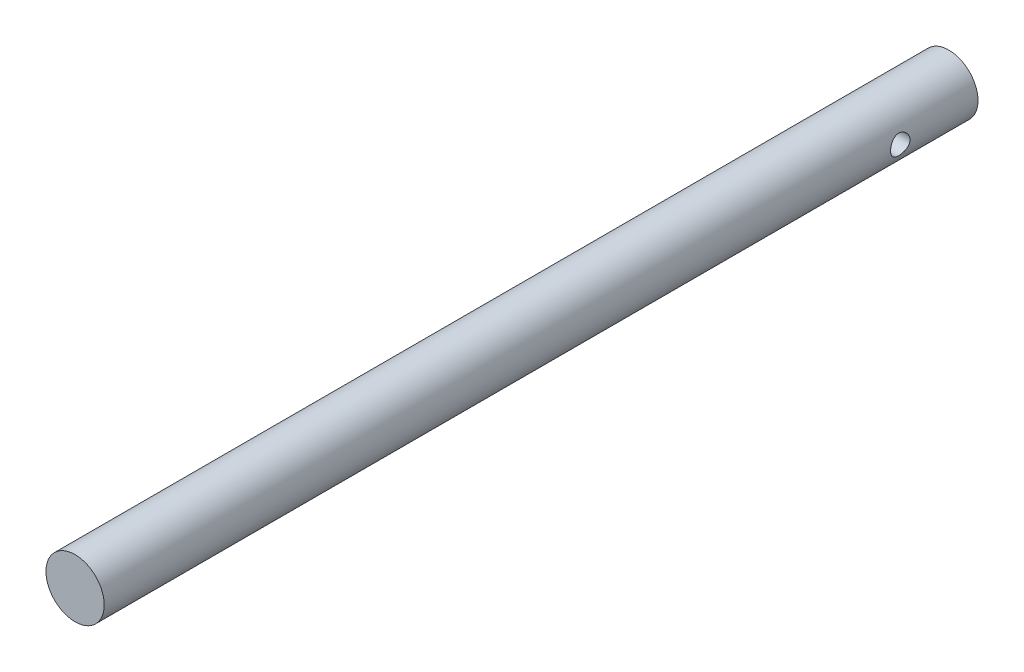
from build123d import *

# Parameters (mm, degrees)
IZIM1_R                                = 4.5
Y_KSEKLIK_EKSTR_ZYON1_DEPTH            = 15
KES_EKSTR_ZYON1_REACH                  = 18.294
KES_EKSTR_ZYON1_END_RADIUS             = 4.5
IZIM2_R                                = 1.5
KES_EKSTR_ZYON1_DIRECTION_2_REACH      = 18.294
KES_EKSTR_ZYON1_DIRECTION_2_END_RADIUS = 4.5
IZIM3_R                                = 4.5
Y_KSEKLIK_EKSTR_ZYON2_DEPTH            = 120


with BuildPart() as part:
    # Çizim1 → Yükseklik-Ekstrüzyon1 (new body)
    with BuildSketch(Plane.XY):
        Circle(IZIM1_R)
    extrude(amount=Y_KSEKLIK_EKSTR_ZYON1_DEPTH)

    # Kes-Ekstrüzyon1: up to this cylinder (the profile starts inside it)
    kes_ekstr_zyon1_end = Plane(origin=(0, 0, 12), z_dir=(0, 0, -1)) * Cylinder(KES_EKSTR_ZYON1_END_RADIUS, 46.588, mode=Mode.PRIVATE)
    # Çizim2 → Kes-Ekstrüzyon1 (cut, up to the surface)
    with BuildSketch(Plane(origin=(0, 0, 0), x_dir=(0, 0, -1), z_dir=(1, 0, 0)), mode=Mode.PRIVATE) as kes_ekstr_zyon1_sk1:
        with Locations((-12, 0)):
            Circle(IZIM2_R)
    kes_ekstr_zyon1_tool1 = extrude(kes_ekstr_zyon1_sk1.sketch, amount=-KES_EKSTR_ZYON1_REACH, mode=Mode.PRIVATE) & kes_ekstr_zyon1_end
    add(kes_ekstr_zyon1_tool1.solids().sort_by_distance((0, 0, 12))[0], mode=Mode.SUBTRACT)

    # Kes-Ekstrüzyon1 direction 2: up to this cylinder (the profile starts inside it)
    kes_ekstr_zyon1_direction_2_end = Plane(origin=(0, 0, 12), z_dir=(0, 0, -1)) * Cylinder(KES_EKSTR_ZYON1_DIRECTION_2_END_RADIUS, 46.588, mode=Mode.PRIVATE)
    # Çizim2 → Kes-Ekstrüzyon1 direction 2 (cut, up to the surface)
    with BuildSketch(Plane(origin=(0, 0, 0), x_dir=(0, 0, -1), z_dir=(1, 0, 0)), mode=Mode.PRIVATE) as kes_ekstr_zyon1_direction_2_sk1:
        with Locations((-12, 0)):
            Circle(IZIM2_R)
    kes_ekstr_zyon1_direction_2_tool1 = extrude(kes_ekstr_zyon1_direction_2_sk1.sketch, amount=KES_EKSTR_ZYON1_DIRECTION_2_REACH, mode=Mode.PRIVATE) & kes_ekstr_zyon1_direction_2_end
    add(kes_ekstr_zyon1_direction_2_tool1.solids().sort_by_distance((0, 0, 12))[0], mode=Mode.SUBTRACT)

    # Çizim3 → Yükseklik-Ekstrüzyon2 (add)
    with BuildSketch(Plane.XY.offset(15)):
        Circle(IZIM3_R)
    extrude(amount=Y_KSEKLIK_EKSTR_ZYON2_DEPTH)


solid = part.part
